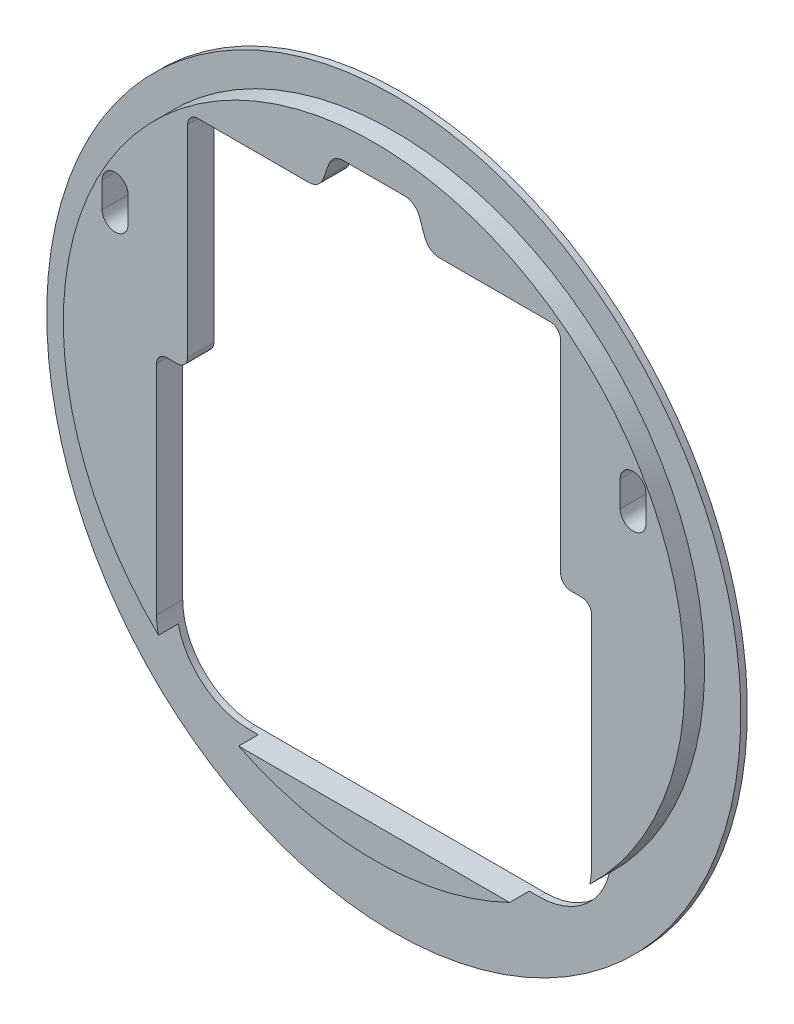
from build123d import *

# Parameters (mm, degrees)
BOSS_EXTRUDE1_DEPTH   = 2.53
BOSS_EXTRUDE1_2_DEPTH = 2.53
BOSS_EXTRUDE3_DEPTH   = 0.63


with BuildPart() as part:
    # Sketch1 → Boss-Extrude1 (new body)
    with BuildSketch(Plane.XY):
        with BuildLine():
            Line((-2.949359103, 29), (2.949359103, 29))
            ThreePointArc((2.949359103, 29), (3.809904892, 28.728601215), (4.359049238, 28.012614595))
            Line((4.359049238, 28.012614595), (4.913678034, 26.487385405))
            ThreePointArc((4.913678034, 26.487385405), (5.462822381, 25.771398785), (6.32336817, 25.5))
            Line((6.32336817, 25.5), (17, 25.5))
            ThreePointArc((17, 25.5), (17.707106781, 25.207106781), (18, 24.5))
            Line((18, 24.5), (18, 5))
            ThreePointArc((18, 5), (18.292893219, 4.292893219), (19, 4))
            Line((19, 4), (20, 4))
            ThreePointArc((20, 4), (20.707106781, 3.707106781), (21, 3))
            Line((21, 3), (21, -18))
            ThreePointArc((21, -18), (20.953183886, -18.808228832), (20.813361759, -19.605646769))
            ThreePointArc((20.813361759, -19.605646769), (0, 32), (-20.813361759, -19.605646769))
            ThreePointArc((-20.813361759, -19.605646769), (-20.953183886, -18.808228832), (-21, -18))
            Line((-21, -18), (-21, 3))
            ThreePointArc((-21, 3), (-20.707106781, 3.707106781), (-20, 4))
            Line((-20, 4), (-19, 4))
            ThreePointArc((-19, 4), (-18.292893219, 4.292893219), (-18, 5))
            Line((-18, 5), (-18, 24.5))
            ThreePointArc((-18, 24.5), (-17.707106781, 25.207106781), (-17, 25.5))
            Line((-17, 25.5), (-6.32336817, 25.5))
            ThreePointArc((-6.32336817, 25.5), (-5.462822381, 25.771398785), (-4.913678034, 26.487385405))
            Line((-4.913678034, 26.487385405), (-4.359049238, 28.012614595))
            ThreePointArc((-4.359049238, 28.012614595), (-3.809904892, 28.728601215), (-2.949359103, 29))
        make_face()
        with BuildLine():
            Line((-26.25, 13.253103865), (-26.25, 15.753103865))
            ThreePointArc((-26.25, 15.753103865), (-25, 17.003103865), (-23.75, 15.753103865))
            Line((-23.75, 15.753103865), (-23.75, 13.253103865))
            ThreePointArc((-23.75, 13.253103865), (-25, 12.003103865), (-26.25, 13.253103865))
        make_face(mode=Mode.SUBTRACT)
        with BuildLine():
            ThreePointArc((23.75, 15.753103865), (25, 17.003103865), (26.25, 15.753103865))
            Line((26.25, 15.753103865), (26.25, 13.253103865))
            ThreePointArc((26.25, 13.253103865), (25, 12.003103865), (23.75, 13.253103865))
            Line((23.75, 13.253103865), (23.75, 15.753103865))
        make_face(mode=Mode.SUBTRACT)
    extrude(amount=BOSS_EXTRUDE1_DEPTH)



with BuildPart() as body_2:
    # Sketch1 → Boss-Extrude1 2 (new body)
    with BuildSketch(Plane.XY):
        with BuildLine():
            ThreePointArc((-13.076696831, -25), (0, -28), (13.076696831, -25))
            Line((13.076696831, -25), (-13.076696831, -25))
        make_face()
    extrude(amount=BOSS_EXTRUDE1_2_DEPTH)


with BuildPart() as part_1:
    add(part.part)

    add(body_2.part)  # Boss-Extrude3 merges body 2
    # Sketch1<5> → Boss-Extrude3 (add)
    with BuildSketch(Plane.XY):
        with BuildLine():
            add(Edge.make_bspline(
                [(0, 35), (-58.023702054, 35), (-29.011851027, -17.5), (0, -70), (29.011851027, -17.5), (58.023702054, 35), (0, 35)],
                knots=[0, 0, 0, 2.094395102, 2.094395102, 4.188790205, 4.188790205, 6.283185307, 6.283185307, 6.283185307], degree=2, weights=[1, 0.5, 1, 0.5, 1, 0.5, 1]))
        make_face()
        with BuildLine():
            ThreePointArc((-20.813361759, -19.605646769), (0, 32), (20.813361759, -19.605646769))
            ThreePointArc((20.813361759, -19.605646769), (18.345139389, -23.488147565), (14, -25))
            Line((14, -25), (13.076696831, -25))
            ThreePointArc((13.076696831, -25), (0, -28), (-13.076696831, -25))
            Line((-13.076696831, -25), (-14, -25))
            ThreePointArc((-14, -25), (-18.345139389, -23.488147565), (-20.813361759, -19.605646769))
        make_face(mode=Mode.SUBTRACT)
    extrude(amount=BOSS_EXTRUDE3_DEPTH)


solid = part_1.part
